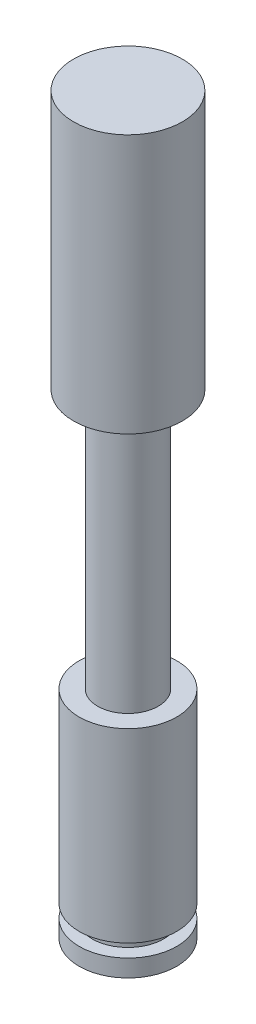
from build123d import *

# Parameters (mm, degrees)
SKETCH1_R           = 5.65
BOSS_EXTRUDE1_DEPTH = 2
SKETCH2_R           = 4.15
BOSS_EXTRUDE2_DEPTH = 1.5
SKETCH3_R           = 5.65
BOSS_EXTRUDE3_DEPTH = 21.5
SKETCH4_R           = 3.5
BOSS_EXTRUDE4_DEPTH = 30
SKETCH5_R           = 6.3
BOSS_EXTRUDE5_DEPTH = 30


with BuildPart() as part:
    # Sketch1 → Boss-Extrude1 (new body)
    with BuildSketch(Plane(origin=(0, 0, 0), x_dir=(1, 0, 0), z_dir=(0, 1, 0))):
        with Locations(Location((0, 0, 0), (0, 0, 270))):
            Circle(SKETCH1_R)
    extrude(amount=BOSS_EXTRUDE1_DEPTH)

    # Sketch2 → Boss-Extrude2 (add)
    with BuildSketch(Plane(origin=(0, 2, 0), x_dir=(1, 0, 0), z_dir=(0, 1, 0))):
        with Locations(Location((0, 0, 0), (0, 0, 270))):
            Circle(SKETCH2_R)
    extrude(amount=BOSS_EXTRUDE2_DEPTH)

    # Sketch3 → Boss-Extrude3 (add)
    with BuildSketch(Plane(origin=(0, 3.5, 0), x_dir=(1, 0, 0), z_dir=(0, 1, 0))):
        with Locations(Location((0, 0, 0), (0, 0, 270))):
            Circle(SKETCH3_R)
    extrude(amount=BOSS_EXTRUDE3_DEPTH)

    # Sketch4 → Boss-Extrude4 (add)
    with BuildSketch(Plane(origin=(0, 25, 0), x_dir=(1, 0, 0), z_dir=(0, 1, 0))):
        with Locations(Location((0, 0, 0), (0, 0, 270))):
            Circle(SKETCH4_R)
    extrude(amount=BOSS_EXTRUDE4_DEPTH)

    # Sketch5 → Boss-Extrude5 (add)
    with BuildSketch(Plane(origin=(0, 55, 0), x_dir=(1, 0, 0), z_dir=(0, 1, 0))):
        with Locations(Location((0, 0, 0), (0, 0, 270))):
            Circle(SKETCH5_R)
    extrude(amount=BOSS_EXTRUDE5_DEPTH)


solid = part.part
